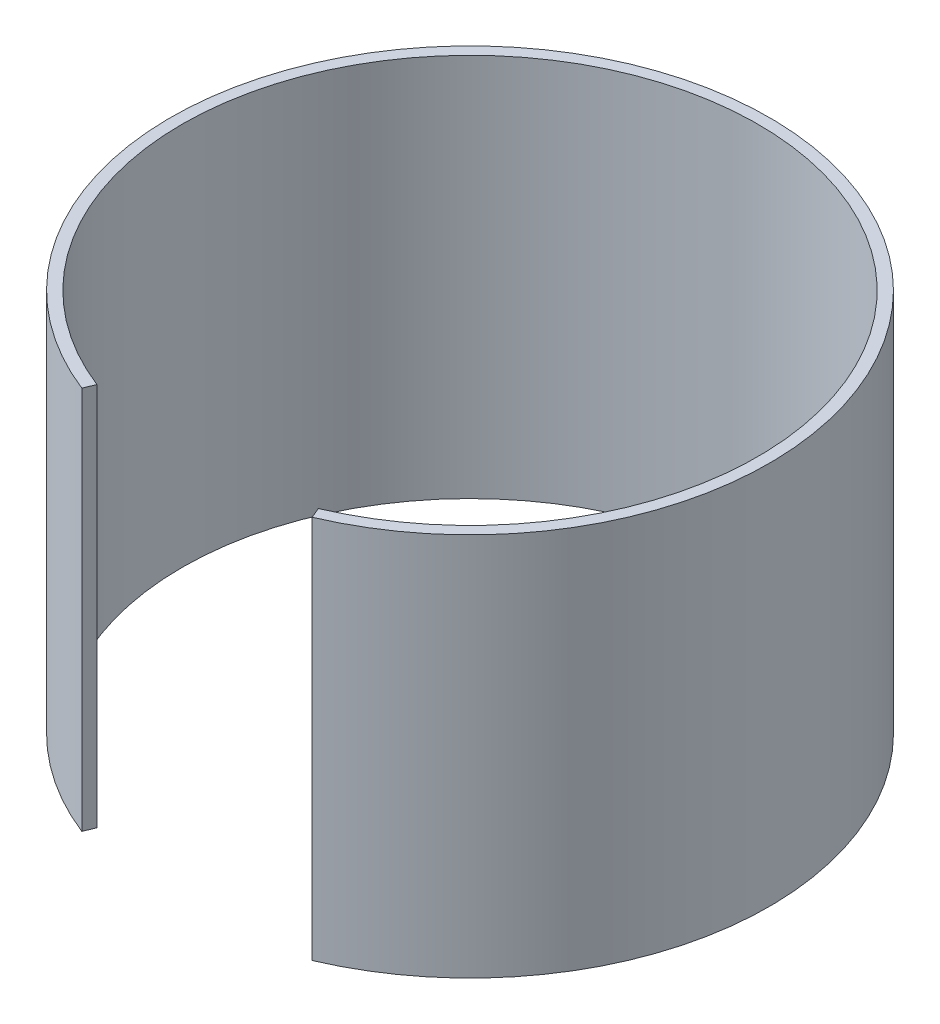
from build123d import *

# Parameters (mm, degrees)
BOSS_EXTRUDE3_DEPTH = 50


with BuildPart() as part:
    # Sketch2 → Boss-Extrude3 (new body)
    with BuildSketch(Plane(origin=(0, 0, 0), x_dir=(1, 0, 0), z_dir=(0, 1, 0))):
        with BuildLine():
            Line((-14.250689398, -36.303138317), (-13.676560587, -34.917068756))
            ThreePointArc((-13.676560587, -34.917068756), (-0.572025793, 37.495636899), (14.735323391, -34.483622846))
            Line((14.735323391, -34.483622846), (15.309382725, -35.869524677))
            ThreePointArc((15.309382725, -35.869524677), (-0.572025426, 38.995804735), (-14.250689398, -36.303138317))
        make_face()
    extrude(amount=BOSS_EXTRUDE3_DEPTH)


solid = part.part
